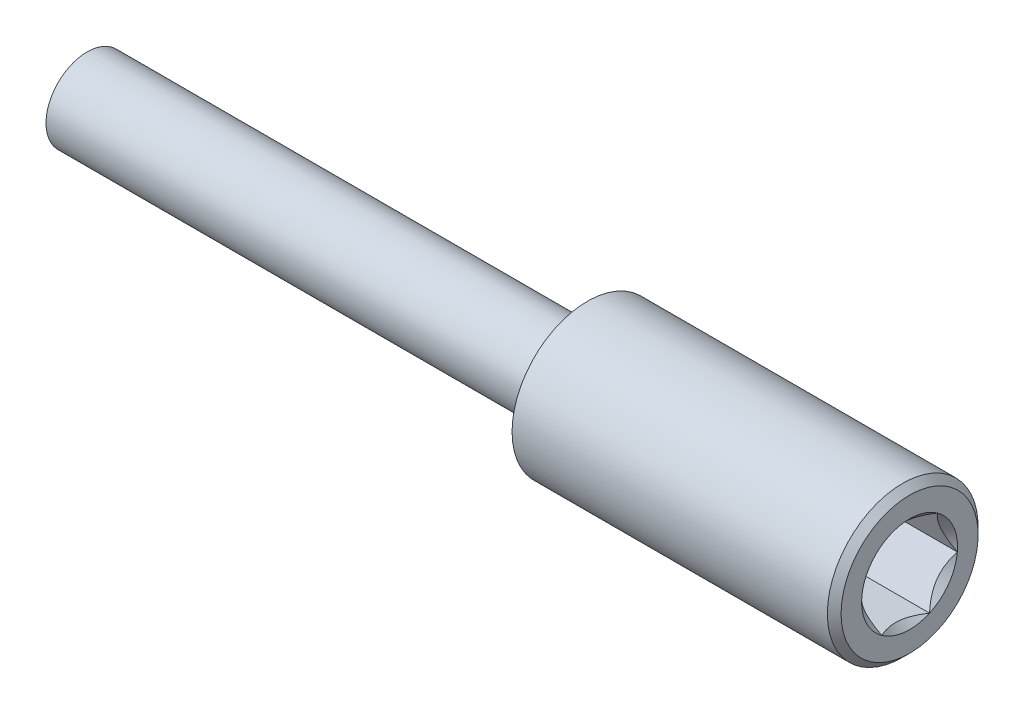
from build123d import *

# Parameters (mm, degrees)
CORTAR_EXTRUIR2_DEPTH = 5


with BuildPart() as part:
    # Croquis1 → Revolución1 (revolve)
    with BuildSketch(Plane(origin=(0, 0, 0), x_dir=(1, 0, 0), z_dir=(0, 1, 0)), mode=Mode.PRIVATE) as revoluci_n1_sk:
        Polygon((0, 0), (49.556624327, 0), (51, 2.5), (58, 2.5), (58, 3), (59.5, 3), (60, 3.5), (60, 5), (59.5, 5.5), (36.5, 5.5), (36.5, 3), (0, 3), align=None)
    revolve(revoluci_n1_sk.sketch.rotate(Axis((0, 0, 0), (1, 0, 0)), 180), axis=Axis((0, 0, 0), (1, 0, 0)))

    # Croquis3 → Cortar-Extruir2 (cut)
    with BuildSketch(Plane(origin=(60, 0, 0), x_dir=(0, 0, -1), z_dir=(1, 0, 0))):
        Polygon((3.484172317, -0.332480476), (2.030022697, 2.8511415), (-1.45414962, 3.183621975), (-3.484172317, 0.332480476), (-2.030022697, -2.8511415), (1.45414962, -3.183621975), align=None)
    extrude(amount=-CORTAR_EXTRUIR2_DEPTH, mode=Mode.SUBTRACT)


solid = part.part
